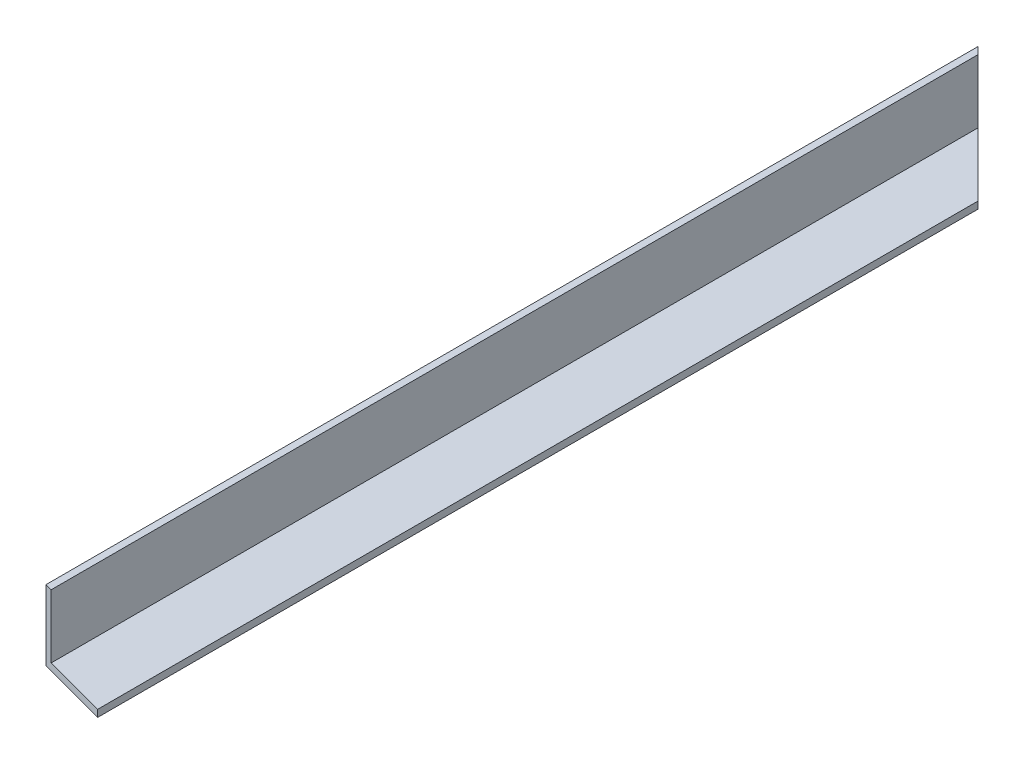
from build123d import *

# Parameters (mm, degrees)
BOSS_EXTRUDE1_DEPTH     = 171.45
CUT_EXTRUDE1_DEPTH      = 173.299266975
CUT_EXTRUDE1_DEPTH_BACK = 173.299266975


with BuildPart() as part:
    # Sketch1 → Boss-Extrude1 (new body)
    with BuildSketch(Plane.XY):
        Polygon((0, 0), (0, 12.7), (1.27, 12.7), (1.27, 1.27), (12.7, 1.27), (12.7, 0), align=None)
    extrude(amount=BOSS_EXTRUDE1_DEPTH)

    # Sketch2 → Cut-Extrude1 (cut, two sides: drawn at the far end of the back side and taken through both)
    with BuildSketch(Plane(origin=(0, 1.27, 0), x_dir=(1, 0, 0), z_dir=(0, 1, 0)).offset(-CUT_EXTRUDE1_DEPTH_BACK)):
        Polygon((0, -168.047045256), (12.7, -171.45), (0, -171.45), align=None)
        Polygon((0, 0), (12.7, -12.7), (12.7, 0), align=None)
    extrude(amount=CUT_EXTRUDE1_DEPTH + CUT_EXTRUDE1_DEPTH_BACK, mode=Mode.SUBTRACT)


solid = part.part
